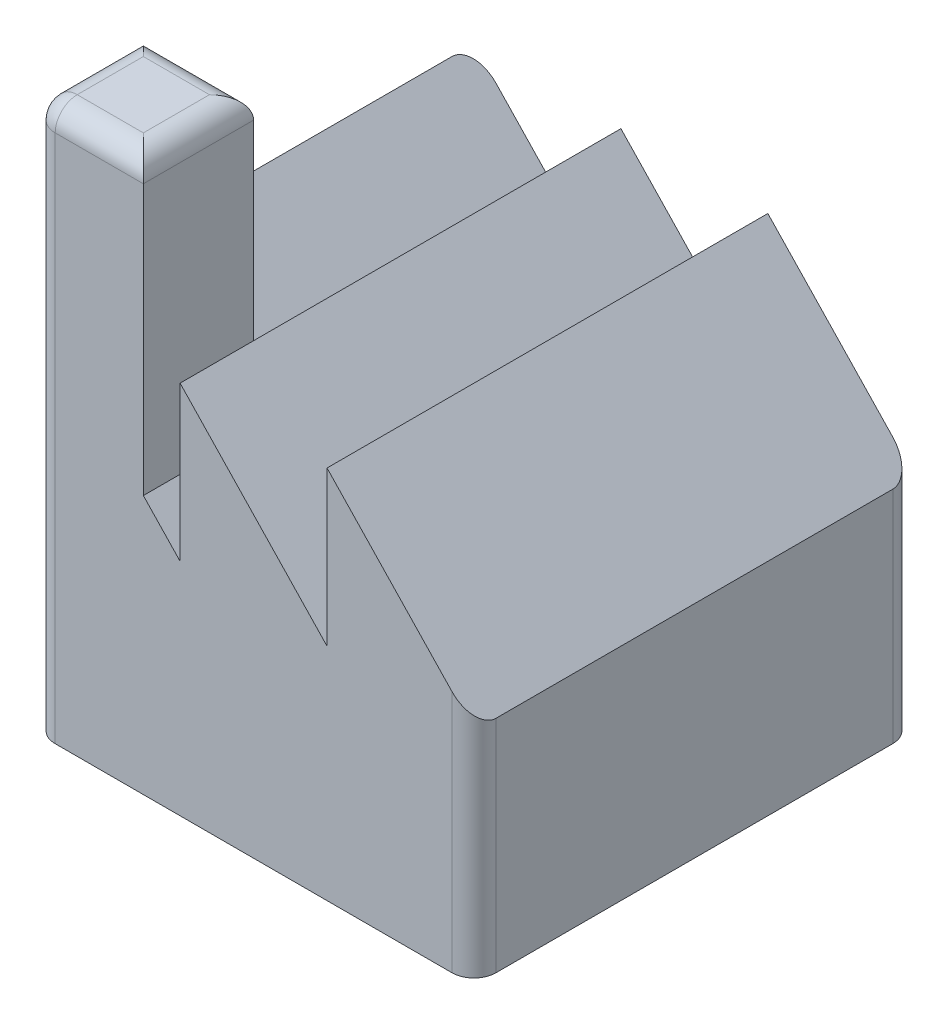
from build123d import *

# Parameters (mm, degrees)
EXTRUDE_1_DEPTH = 20
SKETCH_2_W      = 5
SKETCH_2_H      = 5
EXTRUDE_2_DEPTH = 25
FILLET_1_R      = 1


with BuildPart() as part:
    # 草图1 → 凸台-拉伸1 (new body)
    with BuildSketch(Plane.XY):
        Polygon((-10, 5), (-10, 12), (-3.333333333, 5), (-3.333333333, 12), (3.333333333, 5), (3.333333333, 12), (10, 5), (10, -5), (-10, -5), align=None)
    extrude(amount=EXTRUDE_1_DEPTH)

    # 草图2 → 凸台-拉伸2 (add)
    with BuildSketch(Plane.XZ.offset(5)):
        with Locations((-7.5, 17.5)):
            Rectangle(SKETCH_2_W, SKETCH_2_H)
    extrude(amount=-EXTRUDE_2_DEPTH)

    # 圆角1
    fillet_1_edges = [part.edges().sort_by_distance(p)[0] for p in [
        (-10, 7.5, 20),
        (10, 0, 20),
        (-7.5, 20, 20),
        (-7.5, 20, 15),
        (-10, 20, 17.5),
        (-5, 20, 17.5),
        (10, 0, 0),
        (-10, 3.5, 0),
    ]]
    fillet(fillet_1_edges, radius=FILLET_1_R)


solid = part.part
